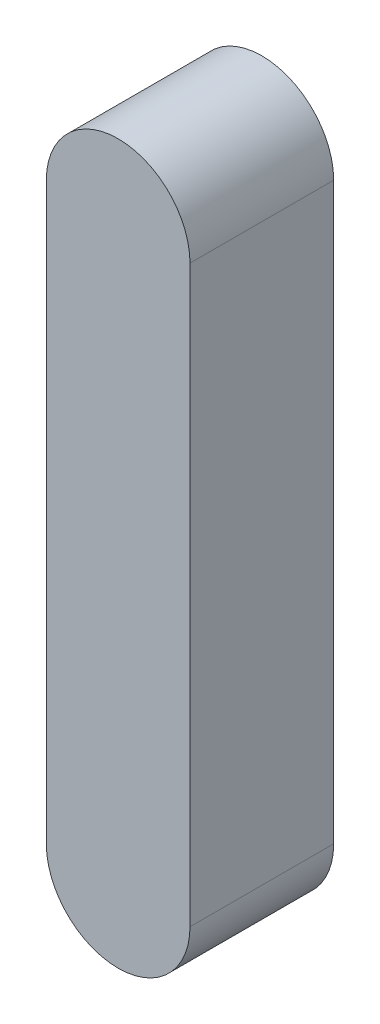
from build123d import *

# Parameters (mm, degrees)
BOSS_EXTRUDE1_DEPTH = 2


with BuildPart() as part:
    # Sketch1 → Boss-Extrude1 (new body)
    with BuildSketch(Plane.XY):
        with BuildLine():
            Line((1, -148), (1, -140))
            ThreePointArc((1, -140), (0, -139), (-1, -140))
            Line((-1, -140), (-1, -148))
            ThreePointArc((-1, -148), (0, -149), (1, -148))
        make_face()
    extrude(amount=BOSS_EXTRUDE1_DEPTH)


solid = part.part
